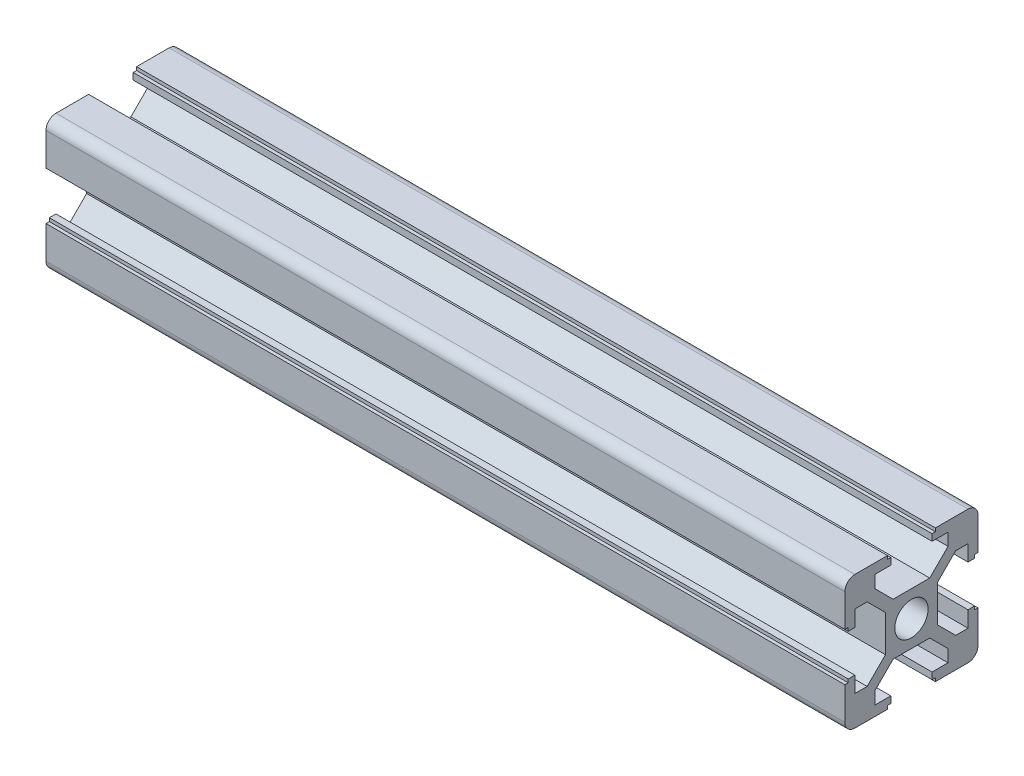
from build123d import *

# Parameters (mm, degrees)
SKETCH1_R                = 2.5
F_20_X_20_X_R1_5_1_DEPTH = 120


with BuildPart() as part:
    # Sketch1 → 铝型材 20 X 20 X R1.5(1) (new body)
    with BuildSketch(Plane(origin=(0, 0, 0), x_dir=(0, 0, -1), z_dir=(1, 0, 0))):
        with BuildLine():
            Line((-3.6, 10), (-3.6, 9.5))
            Line((-3.6, 9.5), (-3.1, 9.5))
            Line((-3.1, 9.5), (-3.1, 8.5))
            Line((-3.1, 8.5), (-5.5, 8.5))
            Line((-5.5, 8.5), (-5.5, 6.65))
            Line((-5.5, 6.65), (-2.75, 3.9))
            Line((-2.75, 3.9), (2.75, 3.9))
            Line((2.75, 3.9), (5.5, 6.65))
            Line((5.5, 6.65), (5.5, 8.5))
            Line((5.5, 8.5), (3.1, 8.5))
            Line((3.1, 8.5), (3.1, 9.5))
            Line((3.1, 9.5), (3.6, 9.5))
            Line((3.6, 9.5), (3.6, 10))
            Line((3.6, 10), (8.5, 10))
            ThreePointArc((8.5, 10), (9.560660172, 9.560660172), (10, 8.5))
            Line((10, 8.5), (10, 3.6))
            Line((10, 3.6), (9.5, 3.6))
            Line((9.5, 3.6), (9.5, 3.1))
            Line((9.5, 3.1), (8.5, 3.1))
            Line((8.5, 3.1), (8.5, 5.5))
            Line((8.5, 5.5), (6.65, 5.5))
            Line((6.65, 5.5), (3.9, 2.75))
            Line((3.9, 2.75), (3.9, -2.75))
            Line((3.9, -2.75), (6.65, -5.5))
            Line((6.65, -5.5), (8.5, -5.5))
            Line((8.5, -5.5), (8.5, -3.1))
            Line((8.5, -3.1), (9.5, -3.1))
            Line((9.5, -3.1), (9.5, -3.6))
            Line((9.5, -3.6), (10, -3.6))
            Line((10, -3.6), (10, -8.5))
            ThreePointArc((10, -8.5), (9.560660172, -9.560660172), (8.5, -10))
            Line((8.5, -10), (3.6, -10))
            Line((3.6, -10), (3.6, -9.5))
            Line((3.6, -9.5), (3.1, -9.5))
            Line((3.1, -9.5), (3.1, -8.5))
            Line((3.1, -8.5), (5.5, -8.5))
            Line((5.5, -8.5), (5.5, -6.65))
            Line((5.5, -6.65), (2.75, -3.9))
            Line((2.75, -3.9), (-2.75, -3.9))
            Line((-2.75, -3.9), (-5.5, -6.65))
            Line((-5.5, -6.65), (-5.5, -8.5))
            Line((-5.5, -8.5), (-3.1, -8.5))
            Line((-3.1, -8.5), (-3.1, -9.5))
            Line((-3.1, -9.5), (-3.6, -9.5))
            Line((-3.6, -9.5), (-3.6, -10))
            Line((-3.6, -10), (-8.5, -10))
            ThreePointArc((-8.5, -10), (-9.560660172, -9.560660172), (-10, -8.5))
            Line((-10, -8.5), (-10, -3.6))
            Line((-10, -3.6), (-9.5, -3.6))
            Line((-9.5, -3.6), (-9.5, -3.1))
            Line((-9.5, -3.1), (-8.5, -3.1))
            Line((-8.5, -3.1), (-8.5, -5.5))
            Line((-8.5, -5.5), (-6.65, -5.5))
            Line((-6.65, -5.5), (-3.9, -2.75))
            Line((-3.9, -2.75), (-3.9, 2.75))
            Line((-3.9, 2.75), (-6.65, 5.5))
            Line((-6.65, 5.5), (-8.5, 5.5))
            Line((-8.5, 5.5), (-8.5, 3.1))
            Line((-8.5, 3.1), (-9.5, 3.1))
            Line((-9.5, 3.1), (-9.5, 3.6))
            Line((-9.5, 3.6), (-10, 3.6))
            Line((-10, 3.6), (-10, 8.5))
            ThreePointArc((-10, 8.5), (-9.560660172, 9.560660172), (-8.5, 10))
            Line((-8.5, 10), (-3.6, 10))
        make_face()
        Circle(SKETCH1_R, mode=Mode.SUBTRACT)
    extrude(amount=F_20_X_20_X_R1_5_1_DEPTH)


solid = part.part
